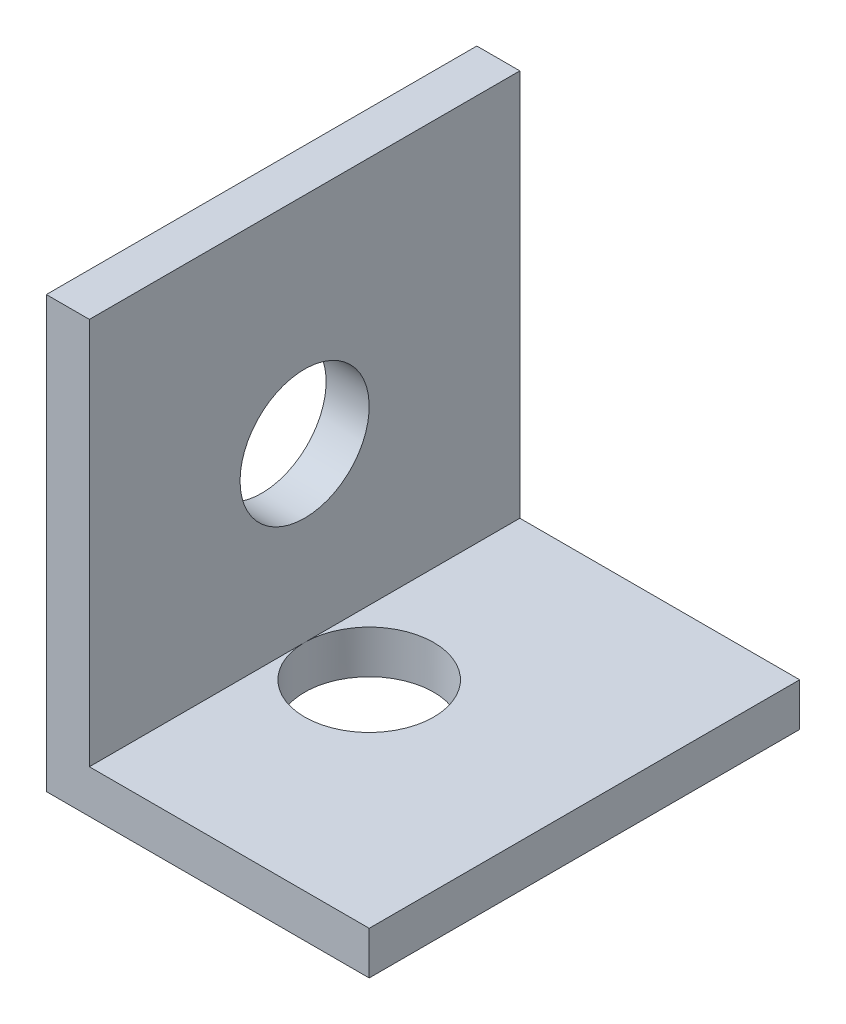
from build123d import *

# Parameters (mm, degrees)
EXTRUDE_1_DEPTH     = 10
SKETCH_2_R          = 3
CUT_EXTRUDE_1_DEPTH = 2
SKETCH_3_R          = 3
CUT_EXTRUDE_2_DEPTH = 2


with BuildPart() as part:
    # 草图1 → 凸台-拉伸1 (new, symmetric)
    with BuildSketch(Plane.XY):
        Polygon((0, 0), (0, 20), (2, 20), (2, 2), (15, 2), (15, 0), align=None)
    extrude(amount=EXTRUDE_1_DEPTH, both=True)

    # 草图2 → 切除-拉伸1 (cut)
    with BuildSketch(Plane.ZY):
        with Locations((0, 10)):
            Circle(SKETCH_2_R)
    extrude(amount=-CUT_EXTRUDE_1_DEPTH, mode=Mode.SUBTRACT)

    # 草图3 → 切除-拉伸2 (cut)
    with BuildSketch(Plane.XZ):
        with Locations((5, 0)):
            Circle(SKETCH_3_R)
    extrude(amount=-CUT_EXTRUDE_2_DEPTH, mode=Mode.SUBTRACT)


solid = part.part
